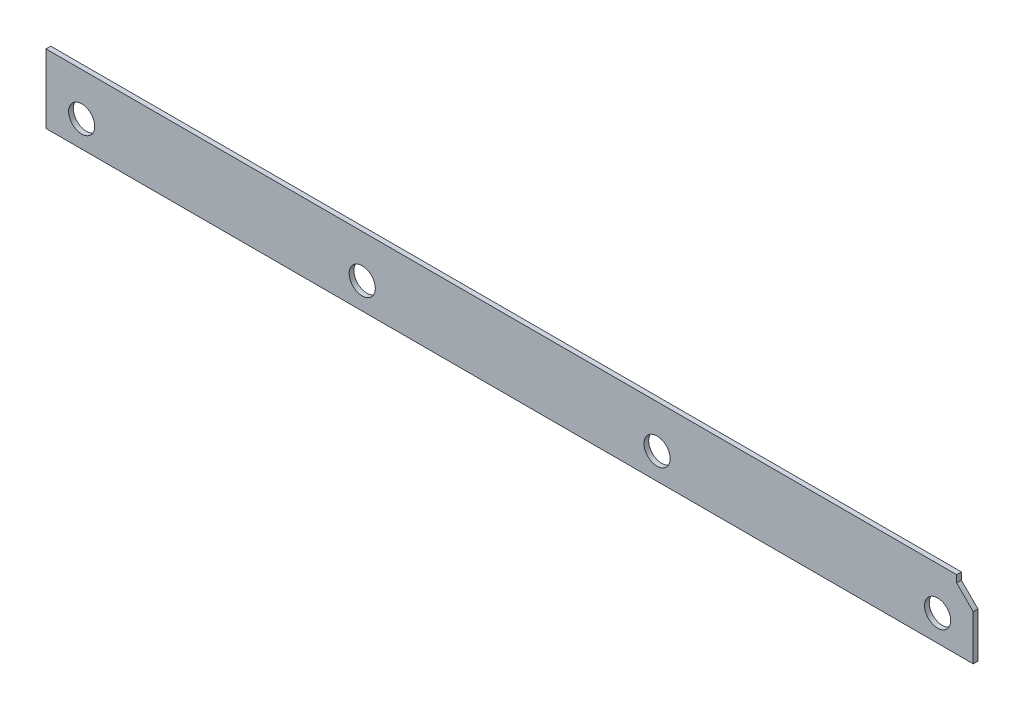
from build123d import *

# Parameters (mm, degrees)
WIDE_FLANGE_WITH_ORIGINAL_FLOOR_BOLT_2_R       = 2.75
WIDE_FLANGE_WITH_ORIGINAL_FLOOR_BOLT_CEN_DEPTH = 1


with BuildPart() as part:
    # Wide flange with original floor bolt 2 → Wide flange with original floor bolt cen (new body)
    with BuildSketch(Plane.XY):
        Polygon((-97.5, -14.5), (97.5, -14.5), (97.5, -5), (94, -1.5), (94, 0), (-97.5, 0), align=None)
        with Locations((-90, -9)):
            Circle(WIDE_FLANGE_WITH_ORIGINAL_FLOOR_BOLT_2_R, mode=Mode.SUBTRACT)
        with Locations((-31, -9)):
            Circle(WIDE_FLANGE_WITH_ORIGINAL_FLOOR_BOLT_2_R, mode=Mode.SUBTRACT)
        with Locations((31, -9)):
            Circle(WIDE_FLANGE_WITH_ORIGINAL_FLOOR_BOLT_2_R, mode=Mode.SUBTRACT)
        with Locations((90, -9)):
            Circle(WIDE_FLANGE_WITH_ORIGINAL_FLOOR_BOLT_2_R, mode=Mode.SUBTRACT)
    extrude(amount=WIDE_FLANGE_WITH_ORIGINAL_FLOOR_BOLT_CEN_DEPTH)


solid = part.part
